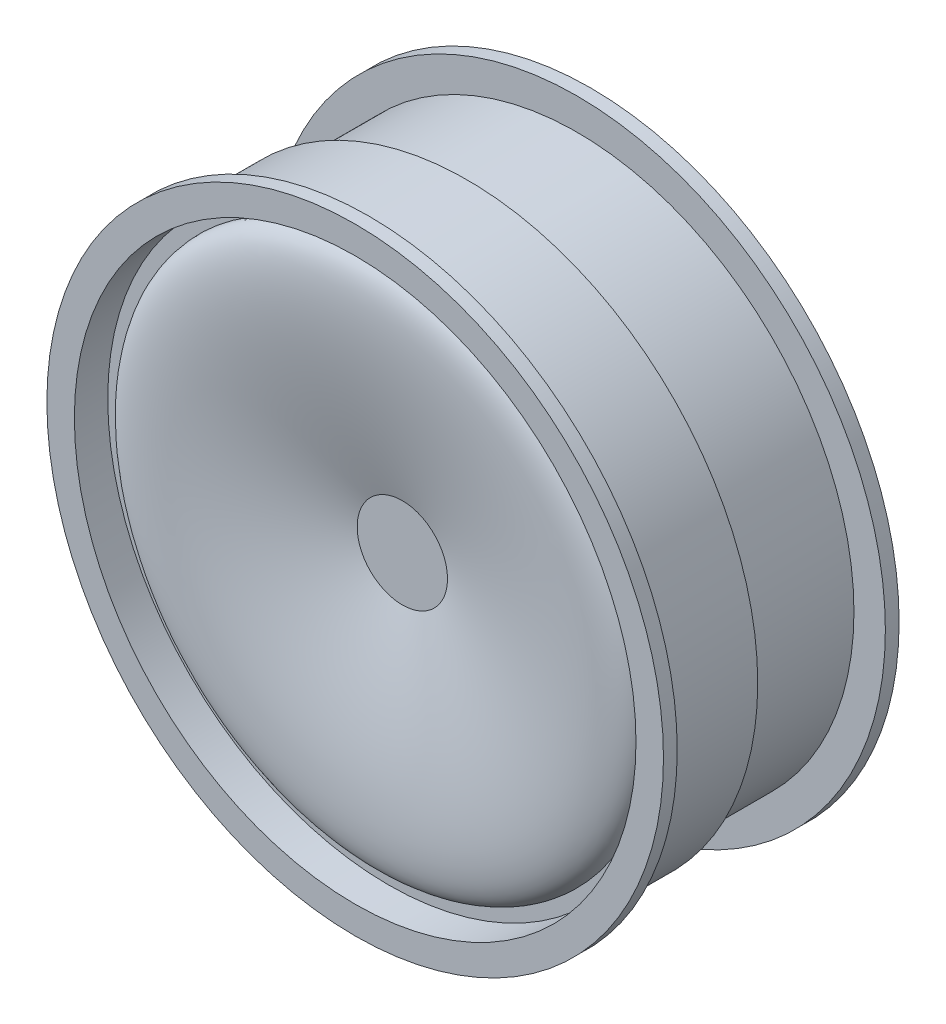
from build123d import *


with BuildPart() as part:
    # Sketch1 → Revolve2 (revolve)
    with BuildSketch(Plane(origin=(0, 0, 0), x_dir=(0, 0, -1), z_dir=(1, 0, 0))):
        with BuildLine():
            Line((0, 0), (2.208762887, 0))
            Line((2.208762887, 0), (2.208762887, 7.5))
            add(Edge.make_bspline(
                [(2.208762887, 7.5), (-4.75, 30), (-2, 32.5), (1.246245651, 32.5)],
                knots=[0, 0, 0, 0, 1, 1, 1, 1], degree=3))
            Line((1.246245651, 32.5), (23.996245651, 32.5))
            Line((23.996245651, 32.5), (23.996245651, 39.25))
            Line((23.996245651, 39.25), (22.246245651, 39.25))
            Line((22.246245651, 39.25), (22.246245651, 35.25))
            Line((22.246245651, 35.25), (8.246245651, 35.25))
            Line((8.246245651, 35.25), (8.246245651, 37))
            Line((8.246245651, 37), (-4.253754349, 37))
            Line((-4.253754349, 37), (-4.253754349, 39.25))
            Line((-4.253754349, 39.25), (-6.003754349, 39.25))
            Line((-6.003754349, 39.25), (-6.003754349, 35.75))
            Line((-6.003754349, 35.75), (-1.753754349, 35.75))
            Line((-1.753754349, 35.75), (-1.753754349, 34))
            add(Edge.make_bspline(
                [(0, 5.75), (-7.5, 30), (-4, 34), (-1.753754349, 34)],
                knots=[0, 0, 0, 0, 1, 1, 1, 1], degree=3))
            Line((0, 5.75), (0, 0))
        make_face()
    revolve(axis=Axis((0, 0, 0), (0, 0, -1)))


solid = part.part
